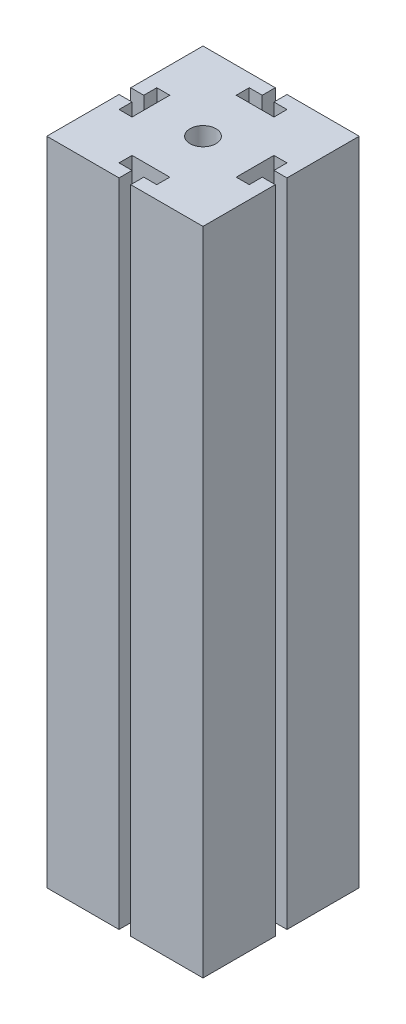
from build123d import *

# Parameters (mm, degrees)
ESQUISSE1_W             = 12
ESQUISSE1_H             = 12
BOSS_EXTRU_1_DEPTH      = 50
ENL_V_MAT_EXTRU_1_DEPTH = 50
ESQUISSE3_R             = 1
ENL_V_MAT_EXTRU_2_DEPTH = 50


with BuildPart() as part:
    # Esquisse1 → Boss.-Extru.1 (new body)
    with BuildSketch(Plane(origin=(0, 0, 0), x_dir=(1, 0, 0), z_dir=(0, 1, 0))):
        Rectangle(ESQUISSE1_W, ESQUISSE1_H)
    extrude(amount=BOSS_EXTRU_1_DEPTH)

    # Esquisse2 → Enlèv. mat.-Extru.1 (cut)
    with BuildSketch(Plane(origin=(0, 50, 0), x_dir=(1, 0, 0), z_dir=(0, 1, 0))):
        Polygon((-5, -0.45), (-5, -1.45), (-4, -1.45), (-4, 1.45), (-5, 1.45), (-5, 0.45), (-6, 0.45), (-6, -0.45), align=None)
        Polygon((1.45, 5), (1.45, 4), (-1.45, 4), (-1.45, 5), (-0.45, 5), (-0.45, 6), (0.45, 6), (0.45, 5), align=None)
        Polygon((5, -1.45), (4, -1.45), (4, 1.45), (5, 1.45), (5, 0.45), (6, 0.45), (6, -0.45), (5, -0.45), align=None)
        Polygon((-1.45, -5), (-1.45, -4), (1.45, -4), (1.45, -5), (0.45, -5), (0.45, -6), (-0.45, -6), (-0.45, -5), align=None)
    extrude(amount=-ENL_V_MAT_EXTRU_1_DEPTH, mode=Mode.SUBTRACT)

    # Esquisse3 → Enlèv. mat.-Extru.2 (cut)
    with BuildSketch(Plane(origin=(0, 50, 0), x_dir=(1, 0, 0), z_dir=(0, 1, 0))):
        with Locations(Location((0, 0, 0), (0, 0, 270))):
            Circle(ESQUISSE3_R)
    extrude(amount=-ENL_V_MAT_EXTRU_2_DEPTH, mode=Mode.SUBTRACT)


solid = part.part
